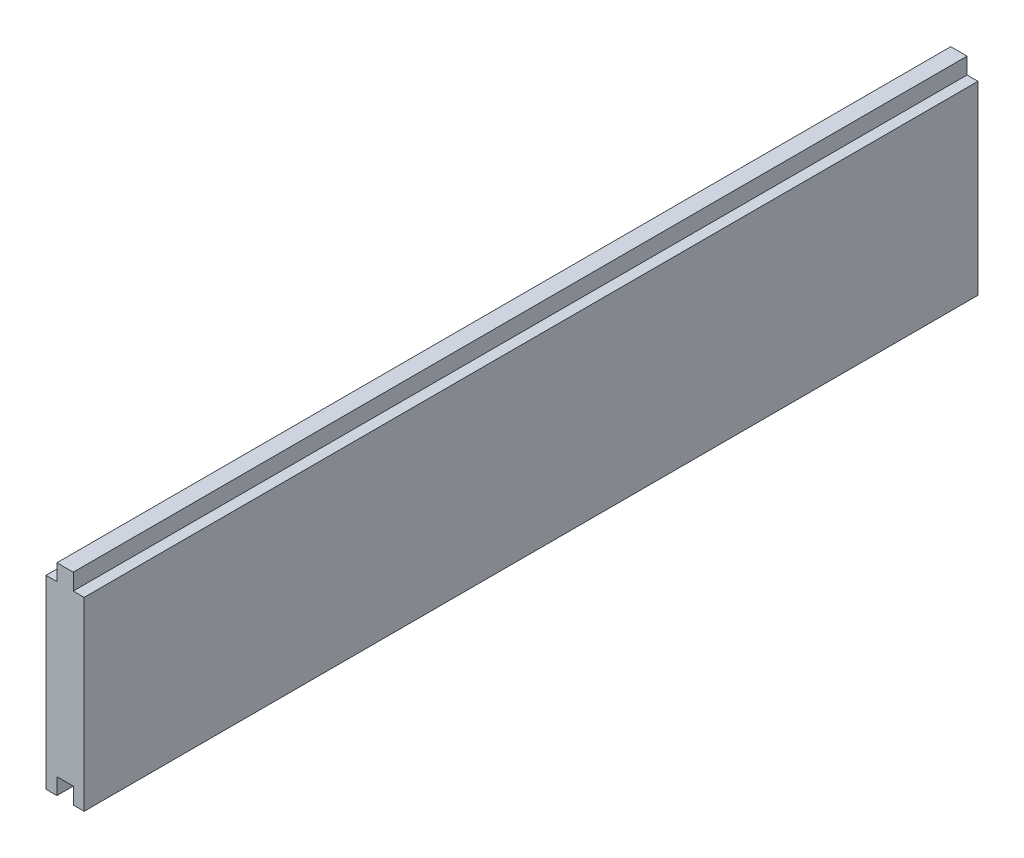
from build123d import *

# Parameters (mm, degrees)
EXTRUDE_1_DEPTH = 820


with BuildPart() as part:
    # Эскиз1 → Бобышка-Вытянуть1 (new body)
    with BuildSketch(Plane.XY):
        Polygon((0, 0), (0, 170), (10, 170), (10, 185), (25, 185), (25, 170), (35, 170), (35, 0), (25, 0), (25, 15), (10, 15), (10, 0), align=None)
    extrude(amount=-EXTRUDE_1_DEPTH)


solid = part.part
